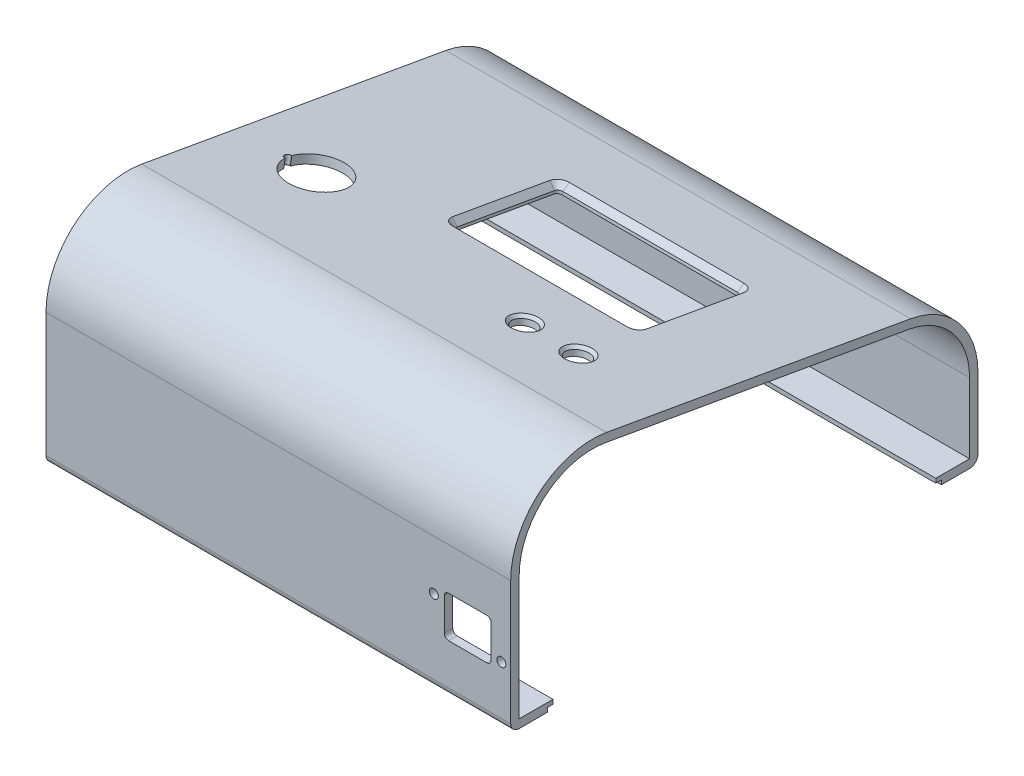
from build123d import *

# Parameters (mm, degrees)
BOSS_EXTRUDE1_DEPTH = 82.55
CUT_EXTRUDE1_REACH  = 139.687
CUT_EXTRUDE2_REACH  = 139.687
SKETCH3_R           = 3.97
SKETCH5_R           = 4.15
CUT_EXTRUDE4_DEPTH  = 1
CUT_EXTRUDE5_REACH  = 191.559
SKETCH6_R           = 1.6
CHAMFER1_SIZE       = 2
CHAMFER2_SIZE       = 1
SKETCH7_W           = 165.1
SKETCH7_H           = 2
CUT_EXTRUDE6_DEPTH  = 1.5


with BuildPart() as part:
    # Sketch1 → Boss-Extrude1 (new, symmetric)
    with BuildSketch(Plane(origin=(0, 0, 0), x_dir=(0, 0, -1), z_dir=(1, 0, 0))):
        with BuildLine():
            Line((-80, -33.521656958), (-80, 10.521656958))
            ThreePointArc((-80, 10.521656958), (-70.712477852, 30.438812479), (-49.485147381, 36.126658537))
            Line((-49.485147381, 36.126658537), (58.514852619, 17.08334462))
            ThreePointArc((58.514852619, 17.08334462), (73.917155521, 8.190820894), (80, -8.521656958))
            Line((80, -8.521656958), (80, -33.521656958))
            Line((80, -33.521656958), (68, -33.521656958))
            Line((68, -33.521656958), (68, -36.521656958))
            Line((68, -36.521656958), (80, -36.521656958))
            ThreePointArc((80, -36.521656958), (82.121320344, -35.642977302), (83, -33.521656958))
            Line((83, -33.521656958), (83, -8.521656958))
            ThreePointArc((83, -8.521656958), (76.21528885, 10.119183723), (59.035797152, 20.037767879))
            Line((59.035797152, 20.037767879), (-48.964202848, 39.081081796))
            ThreePointArc((-48.964202848, 39.081081796), (-72.640840681, 32.736945809), (-83, 10.521656958))
            Line((-83, 10.521656958), (-83, -33.521656958))
            ThreePointArc((-83, -33.521656958), (-82.121320344, -35.642977302), (-80, -36.521656958))
            Line((-80, -36.521656958), (-68, -36.521656958))
            Line((-68, -36.521656958), (-68, -33.521656958))
            Line((-68, -33.521656958), (-80, -33.521656958))
        make_face()
    extrude(amount=BOSS_EXTRUDE1_DEPTH, both=True)

    # Sketch2 → Cut-Extrude1 (cut, up to next)
    with BuildSketch(Plane(origin=(0, 29.529271148, -5.206807224), x_dir=(1, 0, 0), z_dir=(0, 0.984807753012209, -0.1736481776669248)), mode=Mode.PRIVATE) as cut_extrude1_sk1:
        with BuildLine():
            Line((-16, -8.440611136), (46, -8.440611136))
            ThreePointArc((46, -8.440611136), (47.060660172, -8.001271308), (47.5, -6.940611136))
            Line((47.5, -6.940611136), (47.5, 28.159388864))
            ThreePointArc((47.5, 28.159388864), (47.060660172, 29.220049036), (46, 29.659388864))
            Line((46, 29.659388864), (-16, 29.659388864))
            ThreePointArc((-16, 29.659388864), (-17.060660172, 29.220049036), (-17.5, 28.159388864))
            Line((-17.5, 28.159388864), (-17.5, -6.940611136))
            ThreePointArc((-17.5, -6.940611136), (-17.060660172, -8.001271308), (-16, -8.440611136))
        make_face()
    cut_extrude1_tool1 = extrude(cut_extrude1_sk1.sketch, amount=-CUT_EXTRUDE1_REACH, mode=Mode.PRIVATE) & part.part
    add(cut_extrude1_tool1.solids().sort_by_distance((15, 27.68697, -15.655016))[0], mode=Mode.SUBTRACT)

    # Sketch3 → Cut-Extrude2 (cut, up to next)
    with BuildSketch(Plane(origin=(0, 29.529271148, -5.206807224), x_dir=(1, 0, 0), z_dir=(0, 0.984807753012209, -0.1736481776669248)), mode=Mode.PRIVATE) as cut_extrude2_sk1:
        with Locations(Location((49.2, -31.254272732, 0), (0, 0, 270))):
            Circle(SKETCH3_R)
    cut_extrude2_tool1 = extrude(cut_extrude2_sk1.sketch, amount=-CUT_EXTRUDE2_REACH, mode=Mode.PRIVATE) & part.part
    # Sketch3 → Cut-Extrude2 (cut, up to next)
    with BuildSketch(Plane(origin=(0, 29.529271148, -5.206807224), x_dir=(1, 0, 0), z_dir=(0, 0.984807753012209, -0.1736481776669248)), mode=Mode.PRIVATE) as cut_extrude2_sk2:
        with Locations(Location((30.15, -31.254272732, 0), (0, 0, 270))):
            Circle(SKETCH3_R)
    cut_extrude2_tool2 = extrude(cut_extrude2_sk2.sketch, amount=-CUT_EXTRUDE2_REACH, mode=Mode.PRIVATE) & part.part
    # Sketch3 → Cut-Extrude2 (cut, up to next)
    with BuildSketch(Plane(origin=(0, 29.529271148, -5.206807224), x_dir=(1, 0, 0), z_dir=(0, 0.984807753012209, -0.1736481776669248)), mode=Mode.PRIVATE) as cut_extrude2_sk3:
        with BuildLine():
            Line((-64.777738917, -18.950611136), (-65.05, -18.950611136))
            ThreePointArc((-65.05, -18.950611136), (-65.757106781, -19.243504355), (-66.05, -19.950611136))
            Line((-66.05, -19.950611136), (-66.05, -20.350611136))
            ThreePointArc((-66.05, -20.350611136), (-65.757106781, -21.057717917), (-65.05, -21.350611136))
            Line((-65.05, -21.350611136), (-64.777738917, -21.350611136))
            ThreePointArc((-64.777738917, -21.350611136), (-44.85, -20.150611136), (-64.777738917, -18.950611136))
        make_face()
    cut_extrude2_tool3 = extrude(cut_extrude2_sk3.sketch, amount=-CUT_EXTRUDE2_REACH, mode=Mode.PRIVATE) & part.part
    add(cut_extrude2_tool1.solids().sort_by_distance((49.2, 34.956519, 25.572643))[0], mode=Mode.SUBTRACT)
    add(cut_extrude2_tool2.solids().sort_by_distance((30.15, 34.956519, 25.572643))[0], mode=Mode.SUBTRACT)
    add(cut_extrude2_tool3.solids().sort_by_distance((-54.933345, 33.028388, 14.637671))[0], mode=Mode.SUBTRACT)

    # Sketch5 → Cut-Extrude4 (cut)
    with BuildSketch(Plane(origin=(0, 26.574847889, -4.685862691), x_dir=(1, 0, 0), z_dir=(0, -0.984807753012209, 0.1736481776669249))):
        with Locations(Location((57.15, -23.759388864, 0), (0, 0, 270))):
            Circle(SKETCH5_R)
        with Locations(Location((-28.95, -23.759388864, 0), (0, 0, 270))):
            Circle(SKETCH5_R)
        with Locations(Location((-28.95, 7.990611136, 0), (0, 0, 270))):
            Circle(SKETCH5_R)
        with Locations(Location((57.15, 7.990611136, 0), (0, 0, 270))):
            Circle(SKETCH5_R)
    extrude(amount=-CUT_EXTRUDE4_DEPTH, mode=Mode.SUBTRACT)

    # Sketch6 → Cut-Extrude5 (cut, up to next)
    with BuildSketch(Plane.XY.offset(83), mode=Mode.PRIVATE) as cut_extrude5_sk1:
        with Locations((79.225, -16.196656958)):
            Circle(SKETCH6_R)
    cut_extrude5_tool1 = extrude(cut_extrude5_sk1.sketch, amount=-CUT_EXTRUDE5_REACH, mode=Mode.PRIVATE) & part.part
    # Sketch6 → Cut-Extrude5 (cut, up to next)
    with BuildSketch(Plane.XY.offset(83), mode=Mode.PRIVATE) as cut_extrude5_sk2:
        with Locations((55.225, -7.196656958)):
            Circle(SKETCH6_R)
    cut_extrude5_tool2 = extrude(cut_extrude5_sk2.sketch, amount=-CUT_EXTRUDE5_REACH, mode=Mode.PRIVATE) & part.part
    # Sketch6 → Cut-Extrude5 (cut, up to next)
    with BuildSketch(Plane.XY.offset(83), mode=Mode.PRIVATE) as cut_extrude5_sk3:
        with BuildLine():
            Line((60.45, -4.421656958), (74.05, -4.421656958))
            ThreePointArc((74.05, -4.421656958), (75.110660172, -4.860996786), (75.55, -5.921656958))
            Line((75.55, -5.921656958), (75.55, -17.521656958))
            ThreePointArc((75.55, -17.521656958), (75.110660172, -18.58231713), (74.05, -19.021656958))
            Line((74.05, -19.021656958), (60.45, -19.021656958))
            ThreePointArc((60.45, -19.021656958), (59.389339828, -18.58231713), (58.95, -17.521656958))
            Line((58.95, -17.521656958), (58.95, -5.921656958))
            ThreePointArc((58.95, -5.921656958), (59.389339828, -4.860996786), (60.45, -4.421656958))
        make_face()
    cut_extrude5_tool3 = extrude(cut_extrude5_sk3.sketch, amount=-CUT_EXTRUDE5_REACH, mode=Mode.PRIVATE) & part.part
    add(cut_extrude5_tool1.solids().sort_by_distance((79.225, -16.196657, 83))[0], mode=Mode.SUBTRACT)
    add(cut_extrude5_tool2.solids().sort_by_distance((55.225, -7.196657, 83))[0], mode=Mode.SUBTRACT)
    add(cut_extrude5_tool3.solids().sort_by_distance((67.25, -11.721657, 83))[0], mode=Mode.SUBTRACT)

    # Chamfer1
    chamfer1_edges = [part.edges().sort_by_distance(p)[0] for p in [
        (47.060660172, 24.455262881, -33.982938058),
        (15, 24.378972321, -34.415603327),
        (-17.060660172, 24.455262881, -33.982938058),
        (-17.5, 27.686970105, -15.655015632),
        (-17.060660172, 30.918677329, 2.672906794),
        (15, 30.99496789, 3.105572063),
        (47.060660172, 30.918677329, 2.672906794),
        (47.5, 27.686970105, -15.655015632),
    ]]
    chamfer(chamfer1_edges, length=CHAMFER1_SIZE)

    # Chamfer2
    chamfer2_edges = [part.edges().sort_by_distance(p)[0] for p in [
        (49.2, 34.267135387, 21.662956098),
        (30.15, 34.267135387, 21.662956098),
    ]]
    chamfer(chamfer2_edges, length=CHAMFER2_SIZE)

    # Sketch7 → Cut-Extrude6 (cut)
    with BuildSketch(Plane.XZ.offset(36.521656958)):
        with Locations((0, 69)):
            Rectangle(SKETCH7_W, SKETCH7_H)
        with Locations((0, -69)):
            Rectangle(SKETCH7_W, SKETCH7_H)
    extrude(amount=-CUT_EXTRUDE6_DEPTH, mode=Mode.SUBTRACT)


solid = part.part
